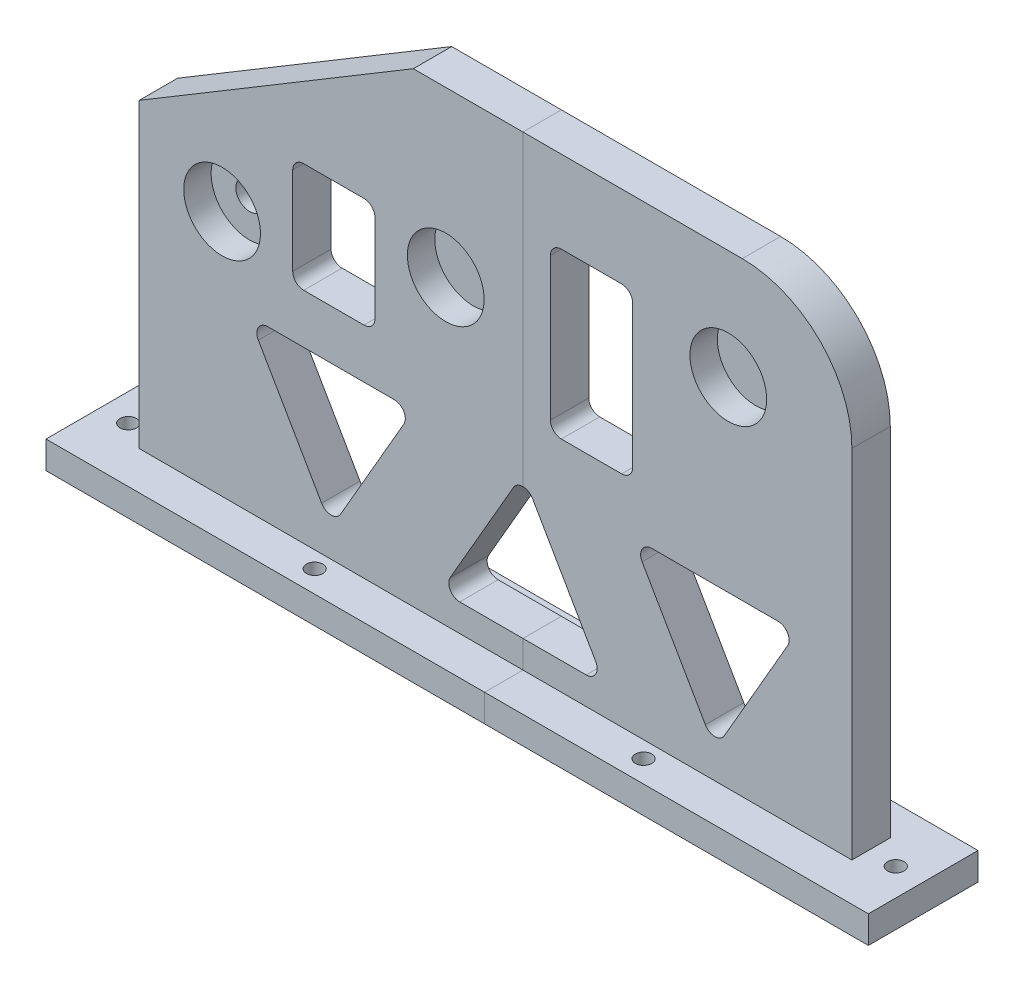
from build123d import *

# Parameters (mm, degrees)
SKETCH_3_W              = 130
SKETCH_3_H              = 90
EXTRUDE_2_DEPTH         = 7
HOLE_WIZARD_14_0_14_1_D = 5
SKETCH_22_R             = 7
CUT_EXTRUDE_4_DEPTH     = 5
CHAMFER_2_SIZE          = 50
CHAMFER_2_SIZE2         = 30
FILLET_3_R              = 20
SKETCH_25_W             = 150
SKETCH_25_H             = 20
EXTRUDE_3_DEPTH         = 5
SKETCH_26_R             = 1.5
CUT_EXTRUDE_5_DEPTH     = 165.380655796
CUT_EXTRUDE_6_REACH     = 168.94
FILLET_4_R              = 2
SKETCH_28_W             = 15
SKETCH_28_H             = 30
SKETCH_28_H_2           = 20
CUT_EXTRUDE_7_DEPTH     = 167.940109021
FILLET_5_R              = 2


with BuildPart() as part:
    # 草图3 → 凸台-拉伸2 (new body)
    with BuildSketch(Plane.XY):
        with Locations((65, 45)):
            Rectangle(SKETCH_3_W, SKETCH_3_H)
    extrude(amount=EXTRUDE_2_DEPTH)

    # Ø14.0 (14) 直径孔1 (through all)
    with Locations(Plane(origin=(0, 0, 0), x_dir=(-1, 0, 0), z_dir=(0, 0, -1))):
        with Locations((-15.120799087, 50)):
            Hole(HOLE_WIZARD_14_0_14_1_D / 2)

    # 草图22 → 切除-拉伸4 (cut)
    with BuildSketch(Plane.XY.offset(7)):
        with Locations((15.120799087, 50)):
            Circle(SKETCH_22_R)
        with Locations((55.912955196, 60)):
            Circle(SKETCH_22_R)
        with Locations((107.451775516, 70)):
            Circle(SKETCH_22_R)
    extrude(amount=-CUT_EXTRUDE_4_DEPTH, mode=Mode.SUBTRACT)

    # 倒角2
    chamfer_2_edges = [part.edges().sort_by_distance(p)[0] for p in [
        (0, 90, 3.5),
    ]]
    chamfer_2_side = [part.faces().sort_by_distance(p)[0] for p in [
        (65, 90, 3.5),
    ]]
    chamfer(chamfer_2_edges, length=CHAMFER_2_SIZE, length2=CHAMFER_2_SIZE2, reference=chamfer_2_side[0])

    # 圆角3
    fillet_3_edges = [part.edges().sort_by_distance(p)[0] for p in [
        (130, 90, 3.5),
    ]]
    fillet(fillet_3_edges, radius=FILLET_3_R)

    # 草图25 → 凸台-拉伸3 (add)
    with BuildSketch(Plane.XZ):
        with Locations((65, 4)):
            Rectangle(SKETCH_25_W, SKETCH_25_H)
    extrude(amount=-EXTRUDE_3_DEPTH)

    # 草图26 → 切除-拉伸5 (cut, through all)
    with BuildSketch(Plane(origin=(0, 5, 0), x_dir=(1, 0, 0), z_dir=(0, 1, 0))):
        with Locations(Location((-5, -4, 0), (0, 0, 180))):
            Circle(SKETCH_26_R)
        with Locations(Location((135, -4, 0), (0, 0, 180))):
            Circle(SKETCH_26_R)
        with Locations(Location((35, -10, 0), (0, 0, 180))):
            Circle(SKETCH_26_R)
        with Locations(Location((95, -10, 0), (0, 0, 180))):
            Circle(SKETCH_26_R)
        with Locations(Location((95, 3, 0), (0, 0, 180))):
            Circle(SKETCH_26_R)
        with Locations(Location((35, 3, 0), (0, 0, 180))):
            Circle(SKETCH_26_R)
    extrude(amount=-CUT_EXTRUDE_5_DEPTH, mode=Mode.SUBTRACT)

    # 草图27 → 切除-拉伸6 (cut, up to next)
    with BuildSketch(Plane.XY.offset(7), mode=Mode.PRIVATE) as cut_extrude_6_sk1:
        Polygon((20, 35.980762114), (50, 35.980762114), (35, 10), align=None)
    cut_extrude_6_tool1 = extrude(cut_extrude_6_sk1.sketch, amount=-CUT_EXTRUDE_6_REACH, mode=Mode.PRIVATE) & part.part
    # 草图27 → 切除-拉伸6 (cut, up to next)
    with BuildSketch(Plane.XY.offset(7), mode=Mode.PRIVATE) as cut_extrude_6_sk2:
        Polygon((55, 10), (85, 10), (70, 35.980762114), align=None)
    cut_extrude_6_tool2 = extrude(cut_extrude_6_sk2.sketch, amount=-CUT_EXTRUDE_6_REACH, mode=Mode.PRIVATE) & part.part
    # 草图27 → 切除-拉伸6 (cut, up to next)
    with BuildSketch(Plane.XY.offset(7), mode=Mode.PRIVATE) as cut_extrude_6_sk3:
        Polygon((90, 35.980762114), (120, 35.980762114), (105, 10), align=None)
    cut_extrude_6_tool3 = extrude(cut_extrude_6_sk3.sketch, amount=-CUT_EXTRUDE_6_REACH, mode=Mode.PRIVATE) & part.part
    add(cut_extrude_6_tool1.solids().sort_by_distance((35, 27.320508, 7))[0], mode=Mode.SUBTRACT)
    add(cut_extrude_6_tool2.solids().sort_by_distance((70, 18.660254, 7))[0], mode=Mode.SUBTRACT)
    add(cut_extrude_6_tool3.solids().sort_by_distance((105, 27.320508, 7))[0], mode=Mode.SUBTRACT)

    # 圆角4
    fillet_4_edges = [part.edges().sort_by_distance(p)[0] for p in [
        (35, 10, 3.5),
        (20, 35.980762114, 3.5),
        (50, 35.980762114, 3.5),
        (55, 10, 3.5),
        (70, 35.980762114, 3.5),
        (85, 10, 3.5),
        (105, 10, 3.5),
        (90, 35.980762114, 3.5),
        (120, 35.980762114, 3.5),
    ]]
    fillet(fillet_4_edges, radius=FILLET_4_R)

    # 草图28 → 切除-拉伸7 (cut, through all)
    with BuildSketch(Plane.XY.offset(7)):
        with Locations((82.5, 60)):
            Rectangle(SKETCH_28_W, SKETCH_28_H)
        with Locations((35.5, 55)):
            Rectangle(SKETCH_28_W, SKETCH_28_H_2)
    extrude(amount=-CUT_EXTRUDE_7_DEPTH, mode=Mode.SUBTRACT)

    # 圆角5
    fillet_5_edges = [part.edges().sort_by_distance(p)[0] for p in [
        (75, 45, 3.5),
        (75, 75, 3.5),
        (90, 75, 3.5),
        (90, 45, 3.5),
        (28, 45, 3.5),
        (28, 65, 3.5),
        (43, 65, 3.5),
        (43, 45, 3.5),
    ]]
    fillet(fillet_5_edges, radius=FILLET_5_R)


with BuildPart() as body_2:
    # Split Bodies 1: the piece on the far side of the plane
    add(part.part)
    split(bisect_by=Plane(origin=(70, 0, 0), x_dir=(0, 0, 1), z_dir=(1, 0, 0)), keep=Keep.BOTTOM)


with BuildPart() as part_1:
    add(part.part)

    # Split Bodies 1
    split(bisect_by=Plane(origin=(70, 0, 0), x_dir=(0, 0, 1), z_dir=(1, 0, 0)), keep=Keep.TOP)


solid = Compound([body_2.part, part_1.part])
